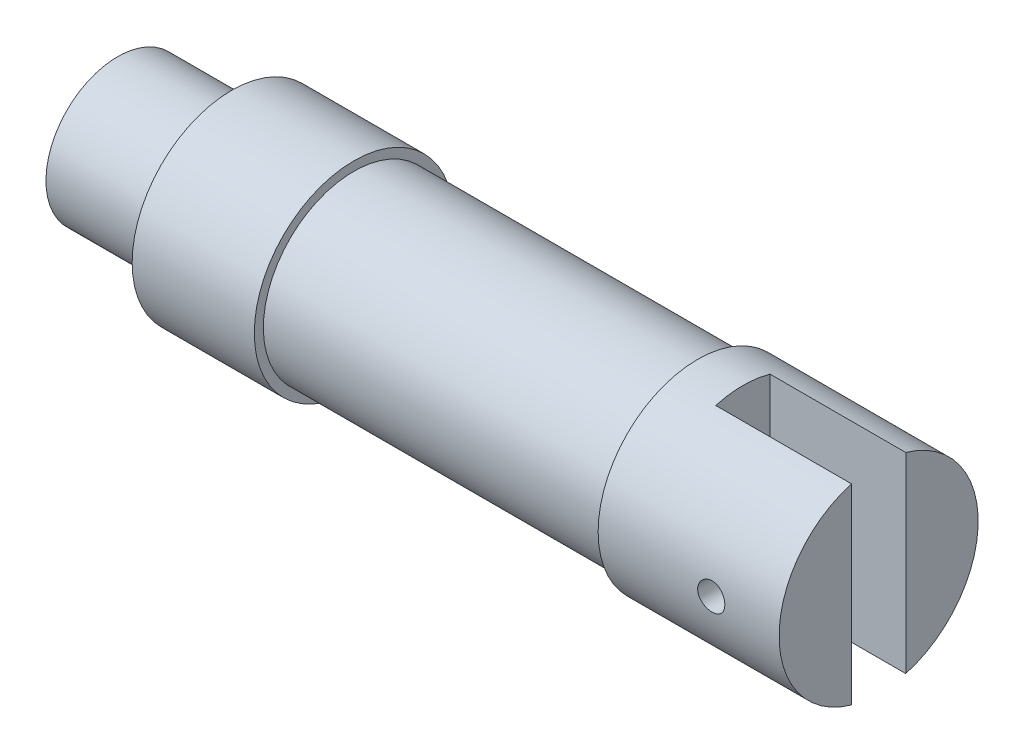
from build123d import *

# Parameters (mm, degrees)
ENL_V_MAT_EXTRU_1_DEPTH      = 172.053325019
ENL_V_MAT_EXTRU_1_DEPTH_BACK = 172.053325019
ESQUISSE2_W                  = 30
ESQUISSE2_H                  = 12
ENL_V_MAT_EXTRU_2_DEPTH      = 172.928008189
ENL_V_MAT_EXTRU_2_DEPTH_BACK = 172.928008189
ESQUISSE3_R                  = 3


with BuildPart() as part:
    # Esquisse1 → Révolution1 (revolve)
    with BuildSketch(Plane.XY, mode=Mode.PRIVATE) as r_volution1_sk:
        Polygon((40, 3), (0, 3), (0, 15.85), (25.2, 15.85), (25.2, 22), (52.2, 22), (52.2, 20), (128.2, 20), (128.2, 22), (168.2, 22), (168.2, 0), (40, 0), align=None)
    revolve(r_volution1_sk.sketch.rotate(Axis((40, 0, 0), (1, 0, 0)), 180), axis=Axis((40, 0, 0), (1, 0, 0)))

    # Esquisse2 → Enlèv. mat.-Extru.1 (cut, two sides: drawn at the far end of the back side and taken through both)
    with BuildSketch(Plane(origin=(0, 0, 0), x_dir=(1, 0, 0), z_dir=(0, 1, 0)).offset(-ENL_V_MAT_EXTRU_1_DEPTH_BACK)):
        with Locations((153.2, 0)):
            Rectangle(ESQUISSE2_W, ESQUISSE2_H)
    extrude(amount=ENL_V_MAT_EXTRU_1_DEPTH + ENL_V_MAT_EXTRU_1_DEPTH_BACK, mode=Mode.SUBTRACT)

    # Esquisse3 → Enlèv. mat.-Extru.2 (cut, two sides: drawn at the far end of the back side and taken through both)
    with BuildSketch(Plane.XY.offset(-6).offset(-ENL_V_MAT_EXTRU_2_DEPTH_BACK)):
        with Locations((153.2, 0)):
            Circle(ESQUISSE3_R)
    extrude(amount=ENL_V_MAT_EXTRU_2_DEPTH + ENL_V_MAT_EXTRU_2_DEPTH_BACK, mode=Mode.SUBTRACT)


solid = part.part
